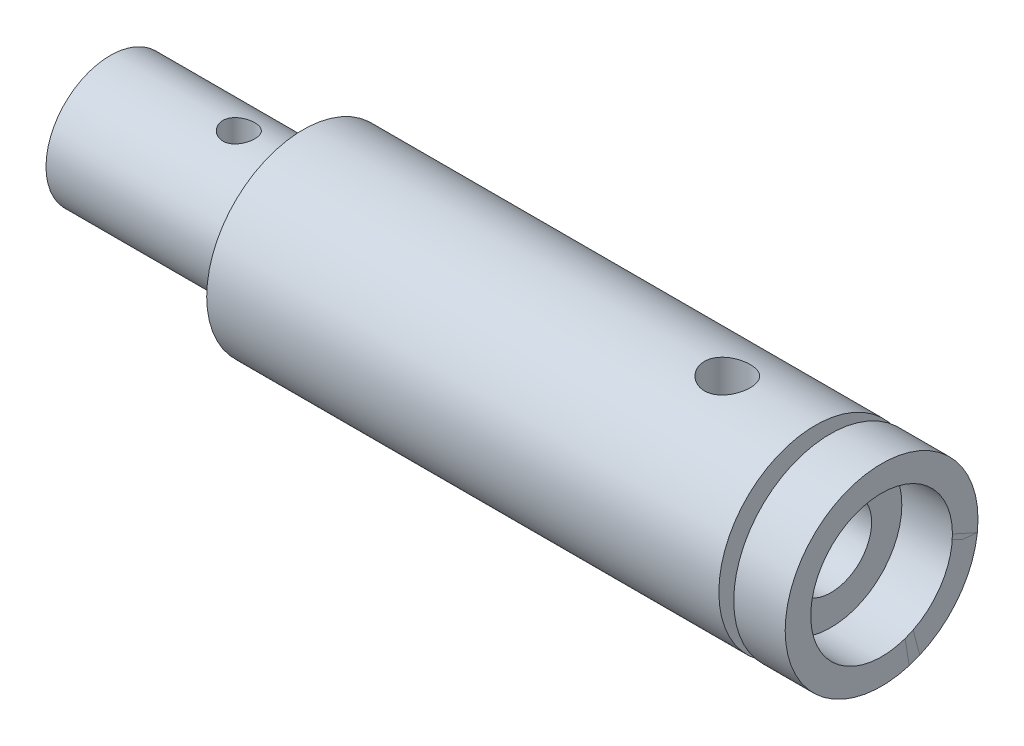
from build123d import *

# Parameters (mm, degrees)
SKETCH1_R               = 4.7625
BOSS_EXTRUDE1_DEPTH     = 38.1
SKETCH2_R               = 2.0066
CUT_EXTRUDE1_DEPTH      = 10.414
SKETCH3_R               = 1.1303
CUT_EXTRUDE2_DEPTH      = 8.6868
SKETCH4_R               = 5.084796601
SKETCH4_R_2             = 3.175
CUT_EXTRUDE3_DEPTH      = 9.525
CUT_EXTRUDE4_DEPTH      = 39.690733028
CUT_EXTRUDE4_DEPTH_BACK = 39.690733028
SKETCH5_R               = 0.7874
SKETCH6_R               = 3.5000057
CUT_EXTRUDE5_DEPTH      = 2.50000008
CUT_EXTRUDE7_START      = -0.7366
SKETCH7_R               = 4.7625
SKETCH7_R_2             = 2.667
CUT_EXTRUDE7_DEPTH      = 0.7366


with BuildPart() as part:
    # Sketch1 → Boss-Extrude1 (new body)
    with BuildSketch(Plane(origin=(0, 0, 0), x_dir=(0, 0, -1), z_dir=(1, 0, 0))):
        with Locations(Location((0, 0, 0), (0, 0, 180))):
            Circle(SKETCH1_R)
    extrude(amount=BOSS_EXTRUDE1_DEPTH)

    # Sketch2 → Cut-Extrude1 (cut)
    with BuildSketch(Plane(origin=(38.1, 0, 0), x_dir=(0, 0, -1), z_dir=(1, 0, 0))):
        Circle(SKETCH2_R)
    extrude(amount=-CUT_EXTRUDE1_DEPTH, mode=Mode.SUBTRACT)

    # Sketch3 → Cut-Extrude2 (cut)
    with BuildSketch(Plane(origin=(0, 0, 0), x_dir=(1, 0, 0), z_dir=(0, 1, 0))):
        with Locations(Location((30.48, 0, 0), (0, 0, 90))):
            Circle(SKETCH3_R)
    extrude(amount=CUT_EXTRUDE2_DEPTH, mode=Mode.SUBTRACT)

    # Sketch4 → Cut-Extrude3 (cut)
    with BuildSketch(Plane.ZY):
        Circle(SKETCH4_R)
        Circle(SKETCH4_R_2, mode=Mode.SUBTRACT)
    extrude(amount=-CUT_EXTRUDE3_DEPTH, mode=Mode.SUBTRACT)

    # Sketch5 → Cut-Extrude4 (cut, two sides: drawn at the far end of the back side and taken through both)
    with BuildSketch(Plane(origin=(0, 0, 0), x_dir=(1, 0, 0), z_dir=(0, 1, 0)).offset(-CUT_EXTRUDE4_DEPTH_BACK)):
        with Locations(Location((6.35, 0, 0), (0, 0, 270))):
            Circle(SKETCH5_R)
    extrude(amount=CUT_EXTRUDE4_DEPTH + CUT_EXTRUDE4_DEPTH_BACK, mode=Mode.SUBTRACT)

    # Sketch6 → Cut-Extrude5 (cut)
    with BuildSketch(Plane(origin=(38.1, 0, 0), x_dir=(0, 0, -1), z_dir=(1, 0, 0))):
        Circle(SKETCH6_R)
    extrude(amount=-CUT_EXTRUDE5_DEPTH, mode=Mode.SUBTRACT)

    # Sketch7 → Cut-Extrude7 (cut)
    with BuildSketch(Plane(origin=(35.56, 0, 0), x_dir=(0, 0, -1), z_dir=(1, 0, 0)).offset(CUT_EXTRUDE7_START)):
        with Locations(Location((0, 0, 0), (0, 0, 180))):
            Circle(SKETCH7_R)
        Circle(SKETCH7_R_2, mode=Mode.SUBTRACT)
    extrude(amount=CUT_EXTRUDE7_DEPTH, mode=Mode.SUBTRACT)


solid = part.part
